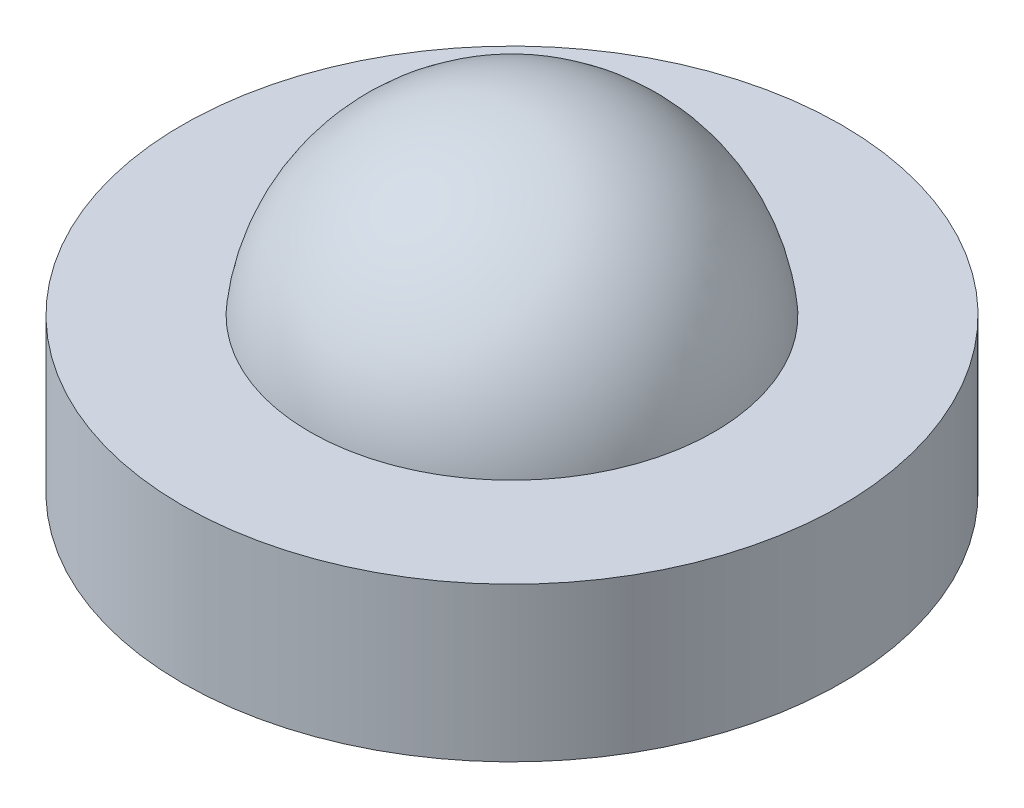
from build123d import *

# Parameters (mm, degrees)
BOSS_EXTRUDE5_DEPTH       = 0.127
BOSS_EXTRUDE5_DEPTH_BACK  = 31.877
SKETCH8_R                 = 54.624765446
CIRPATTERN1_COUNT         = 3
REVOLVE3_ANGLE            = 180
BOSS_EXTRUDE11_DEPTH      = 3.175
BOSS_EXTRUDE11_DEPTH_BACK = 38.1
SKETCH12_R                = 88.392973166


with BuildPart() as part:
    # Sweep1: sweep along a path in Sketch2
    with BuildLine(Plane(origin=(0, 0, -9.525), x_dir=(-1, 0, 0), z_dir=(0, 0, -1))) as sweep1_path:
        Line((0, 0), (-31.75, 31.75))
    # Sketch6 → Sweep1 (sweep)
    with BuildSketch(Plane(origin=(0, 0, 0), x_dir=(1, 0, 0), z_dir=(0, 1, 0))):
        with BuildLine():
            Line((0, -44.45), (0, -43.18))
            ThreePointArc((0, -43.18), (-43.489984476, 39.298113295), (49.135081491, 28.592270173))
            Line((49.135081491, 28.592270173), (50.319059359, 29.051722466))
            ThreePointArc((50.319059359, 29.051722466), (-44.537935909, 40.015537712), (0, -44.45))
        make_face()
    sweep(path=sweep1_path.line)

    # Sketch8 → Boss-Extrude5 (add, two sides: drawn at the far end of the back side and taken through both)
    with BuildSketch(Plane(origin=(0, 31.877, 0), x_dir=(1, 0, 0), z_dir=(0, 1, 0)).offset(-BOSS_EXTRUDE5_DEPTH_BACK)):
        with Locations(Location((0, 0, 0), (0, 0, 87.860810676))):
            Circle(SKETCH8_R)
    extrude(amount=BOSS_EXTRUDE5_DEPTH + BOSS_EXTRUDE5_DEPTH_BACK)


with BuildPart() as cirpattern1_1:
    # CirPattern1: pattern copy
    add(part.part.rotate(Axis((0, 32.004, 0), (0, -1, 0)), 1 * 360 / CIRPATTERN1_COUNT))


with BuildPart() as cirpattern1_2:
    # CirPattern1: pattern copy
    add(part.part.rotate(Axis((0, 32.004, 0), (0, -1, 0)), 2 * 360 / CIRPATTERN1_COUNT))


with BuildPart() as body_4:
    # Sketch8<5> → Revolve3 (revolve)
    with BuildSketch(Plane(origin=(0, 31.877, 0), x_dir=(1, 0, 0), z_dir=(0, 1, 0))):
        with BuildLine():
            ThreePointArc((54.624765446, 0), (0, 54.624765446), (-54.624765446, 0))
            Line((-54.624765446, 0), (54.624765446, 0))
        make_face()
    revolve(axis=Axis((-54.624765446, 31.877, 0), (1, 0, 0)), revolution_arc=REVOLVE3_ANGLE)


with BuildPart() as body_5:
    # Sketch12 → Boss-Extrude11 (new, two sides: drawn at the far end of the back side and taken through both)
    with BuildSketch(Plane.XZ.offset(-BOSS_EXTRUDE11_DEPTH_BACK)):
        with Locations(Location((0, 0, 0), (0, 0, 270))):
            Circle(SKETCH12_R)
    extrude(amount=BOSS_EXTRUDE11_DEPTH + BOSS_EXTRUDE11_DEPTH_BACK)


solid = Compound([part.part, cirpattern1_1.part, cirpattern1_2.part, body_4.part, body_5.part])
